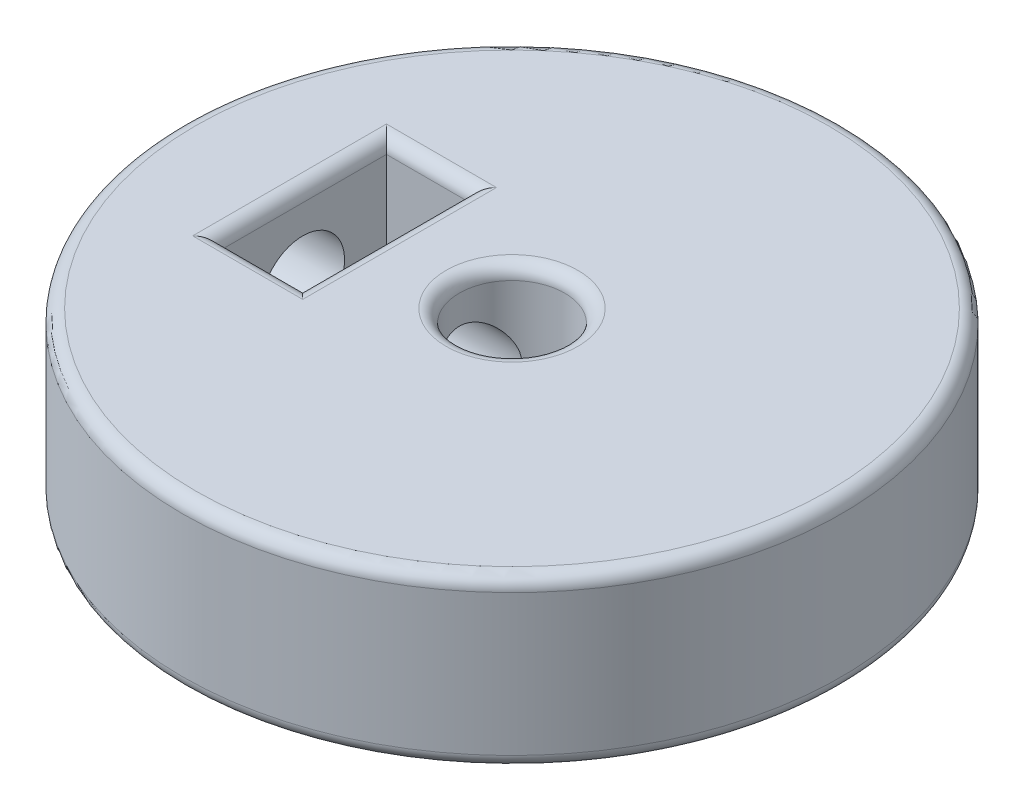
from build123d import *

# Parameters (mm, degrees)
SKETCH1_R                      = 25
SKETCH1_R_2                    = 4
BOSS_EXTRUDE1_DEPTH            = 12.7
SKETCH2_W                      = 6.35
SKETCH2_H                      = 12.7
CUT_EXTRUDE1_DEPTH             = 38.567139896
SKETCH3_R                      = 3.175
CUT_EXTRUDE2_DEPTH             = 45.477698063
CUT_EXTRUDE2_DIRECTION_2_REACH = 46.478
FILLET1_R                      = 1


with BuildPart() as part:
    # Sketch1 → Boss-Extrude1 (new body)
    with BuildSketch(Plane(origin=(0, 0, 0), x_dir=(1, 0, 0), z_dir=(0, 1, 0))):
        with Locations(Location((0, 0, 0), (0, 0, 270))):
            Circle(SKETCH1_R)
        with Locations(Location((0, 0, 0), (0, 0, 270))):
            Circle(SKETCH1_R_2, mode=Mode.SUBTRACT)
    extrude(amount=BOSS_EXTRUDE1_DEPTH)

    # Sketch2 → Cut-Extrude1 (cut, through all)
    with BuildSketch(Plane(origin=(0, 12.7, 0), x_dir=(1, 0, 0), z_dir=(0, 1, 0))):
        with Locations((-12.7, 0)):
            Rectangle(SKETCH2_W, SKETCH2_H)
    extrude(amount=-CUT_EXTRUDE1_DEPTH, mode=Mode.SUBTRACT)

    # Sketch3 → Cut-Extrude2 (cut)
    with BuildSketch(Plane.ZY.offset(9.525)):
        with Locations((0, 6.35)):
            Circle(SKETCH3_R)
    extrude(amount=CUT_EXTRUDE2_DEPTH, mode=Mode.SUBTRACT)

    # Sketch3 → Cut-Extrude2 direction 2 (cut, up to next)
    with BuildSketch(Plane.ZY.offset(9.525), mode=Mode.PRIVATE) as cut_extrude2_direction_2_sk1:
        with Locations((0, 6.35)):
            Circle(SKETCH3_R)
    cut_extrude2_direction_2_tool1 = extrude(cut_extrude2_direction_2_sk1.sketch, amount=-CUT_EXTRUDE2_DIRECTION_2_REACH, mode=Mode.PRIVATE) & part.part
    add(cut_extrude2_direction_2_tool1.solids().sort_by_distance((-9.525, 6.35, 0))[0], mode=Mode.SUBTRACT)

    # Fillet1
    fillet1_edges = [part.edges().sort_by_distance(p)[0] for p in [
        (-15.875, 0, 0),
        (-12.7, 0, -6.35),
        (-9.525, 0, 0),
        (-12.7, 0, 6.35),
        (-15.875, 12.7, 0),
        (-12.7, 12.7, 6.35),
        (-9.525, 12.7, 0),
        (-12.7, 12.7, -6.35),
        (0, 0, -25),
        (0, 12.7, -25),
        (0, 0, -4),
        (0, 12.7, -4),
    ]]
    fillet(fillet1_edges, radius=FILLET1_R)


solid = part.part
